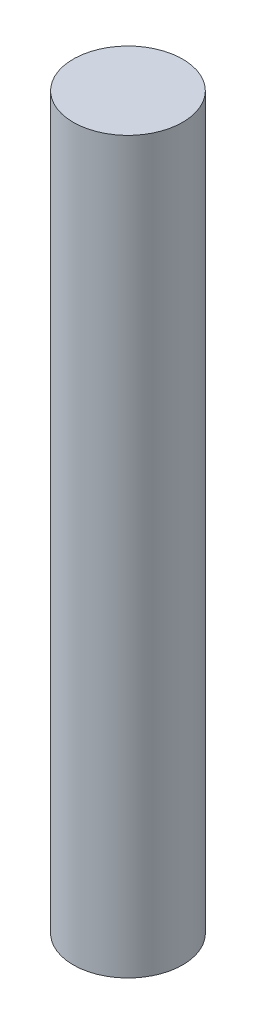
from build123d import *

# Parameters (mm, degrees)
SKETCH_1_R      = 1.5
EXTRUDE_1_DEPTH = 20


with BuildPart() as part:
    # 草圖1 → 填料-伸長1 (new body)
    with BuildSketch(Plane(origin=(0, 0, 0), x_dir=(1, 0, 0), z_dir=(0, 1, 0))):
        with Locations(Location((0, 0, 0), (0, 0, 270))):
            Circle(SKETCH_1_R)
    extrude(amount=EXTRUDE_1_DEPTH)


solid = part.part
